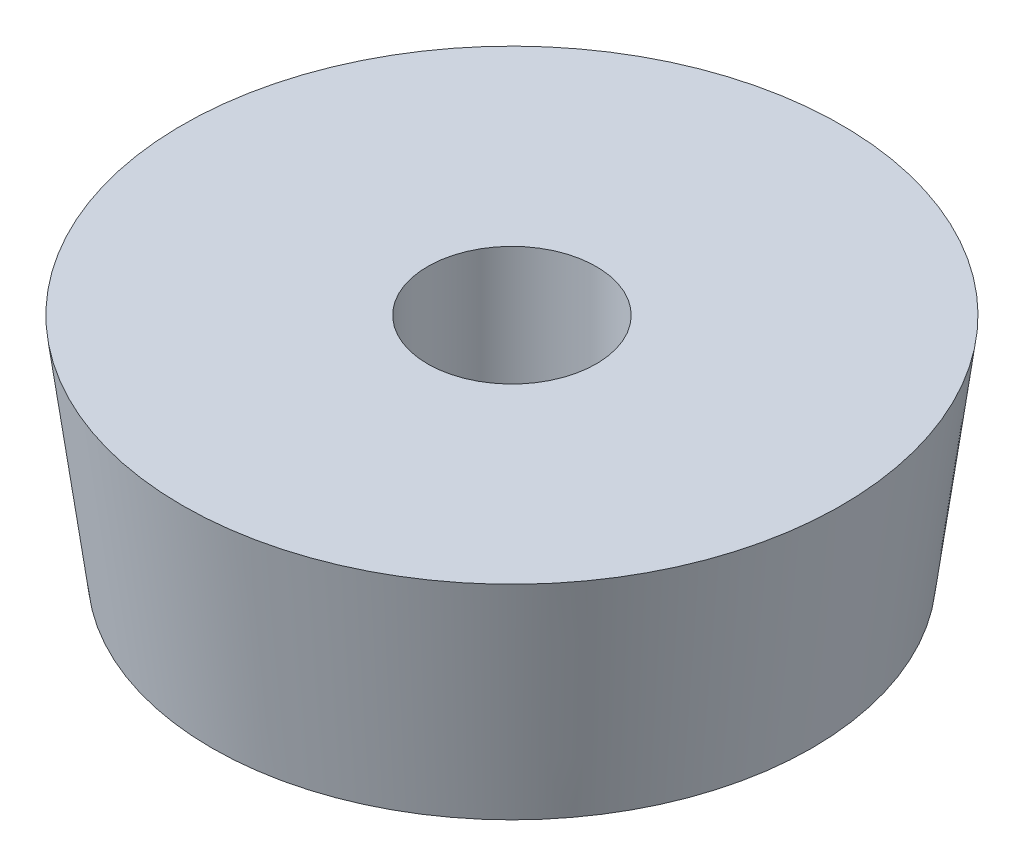
from build123d import *

# Parameters (mm, degrees)
SKETCH2_R           = 50.8
BOSS_EXTRUDE3_DEPTH = 38.1
BOSS_EXTRUDE3_DRAFT = -7.5
SKETCH3_R           = 14.2875
CUT_EXTRUDE1_DEPTH  = 88.64960249


with BuildPart() as part:
    # Sketch2 → Boss-Extrude3 (with draft: the straight prism first)
    with BuildSketch(Plane(origin=(0, 0, 0), x_dir=(1, 0, 0), z_dir=(0, 1, 0))):
        Circle(SKETCH2_R)
    extrude(amount=BOSS_EXTRUDE3_DEPTH)
    # Boss-Extrude3: the draft: its side faces are tilted about the plane it starts from
    boss_extrude3_sides = [part.faces().sort_by_distance(p)[0] for p in [
        (-50.8, 19.05, 0),
    ]]
    draft(boss_extrude3_sides, Plane(origin=(0, 0, 0), x_dir=(1, 0, 0), z_dir=(0, 1, 0)), BOSS_EXTRUDE3_DRAFT)

    # Sketch3 → Cut-Extrude1 (cut, through all)
    with BuildSketch(Plane(origin=(0, 38.1, 0), x_dir=(1, 0, 0), z_dir=(0, 1, 0))):
        with Locations(Location((0, 0, 0), (0, 0, 270))):
            Circle(SKETCH3_R)
    extrude(amount=-CUT_EXTRUDE1_DEPTH, mode=Mode.SUBTRACT)


solid = part.part
